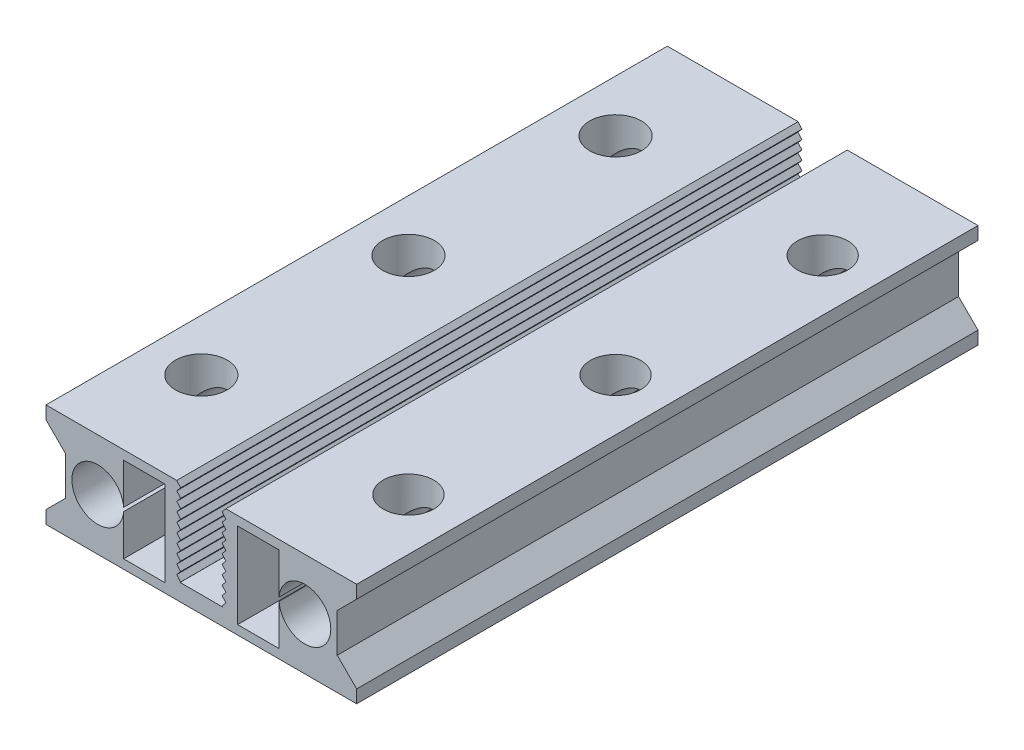
from build123d import *

# Parameters (mm, degrees)
EXTRUDE_2_DEPTH        = 48
EXTRUDE_3_DEPTH        = 48
PATTERN_LINEAR_1_COUNT = 10
PATTERN_LINEAR_1_PITCH = 0.7
MIRROR_1_COPY_1_DEPTH  = 48
MIRROR_1_COPY_2_DEPTH  = 48
MIRROR_1_COPY_3_DEPTH  = 48
MIRROR_1_COPY_4_DEPTH  = 48
MIRROR_1_COPY_5_DEPTH  = 48
MIRROR_1_COPY_6_DEPTH  = 48
MIRROR_1_COPY_7_DEPTH  = 48
MIRROR_1_COPY_8_DEPTH  = 48
MIRROR_1_COPY_9_DEPTH  = 48
SKETCH_4_R             = 2
SKETCH_4_R_2           = 1.95
CUT_EXTRUDE_1_DEPTH    = 51.119856345
PATTERN_LINEAR_2_COUNT = 3
PATTERN_LINEAR_2_PITCH = 16


with BuildPart() as part:
    # 草图1 → 凸台-拉伸2 (new body)
    with BuildSketch(Plane.XY):
        Polygon((-1.9, 8), (-12, 8), (-12, 7), (-10.5, 5.5), (-10.5, 2.5), (-12, 1), (-12, 0), (12, 0), (12, 1), (10.5, 2.5), (10.5, 5.5), (12, 7), (12, 8), (1.9, 8), (1.9, 1.3), (-1.9, 1.3), align=None)
        with BuildLine():
            Line((-6.005, 4.14133294), (-6.005, 7.3))
            Line((-6.005, 7.3), (-2.8, 7.3))
            Line((-2.8, 7.3), (-2.8, 0.7))
            Line((-2.8, 0.7), (-6.005, 0.7))
            Line((-6.005, 0.7), (-6.005, 3.85866706))
            ThreePointArc((-6.005, 3.85866706), (-10, 4), (-6.005, 4.14133294))
        make_face(mode=Mode.SUBTRACT)
        with BuildLine():
            Line((2.8, 0.7), (2.8, 7.3))
            Line((2.8, 7.3), (6.005, 7.3))
            Line((6.005, 7.3), (6.005, 4.14133294))
            ThreePointArc((6.005, 4.14133294), (10, 4), (6.005, 3.85866706))
            Line((6.005, 3.85866706), (6.005, 0.7))
            Line((6.005, 0.7), (2.8, 0.7))
        make_face(mode=Mode.SUBTRACT)
    extrude(amount=EXTRUDE_2_DEPTH)

    # 草图3 → 凸台-拉伸3 (add)
    with BuildSketch(Plane.XY.offset(48)):
        Polygon((-1.9, 8), (-1.6, 7.65), (-1.9, 7.3), align=None)
    extrude_3 = extrude(amount=-EXTRUDE_3_DEPTH)

    # 阵列(线性)1: 凸台-拉伸3 ×10
    with Locations(*[(0, -i * PATTERN_LINEAR_1_PITCH, 0) for i in range(1, PATTERN_LINEAR_1_COUNT)]):
        add(extrude_3)

    # 镜向1: 凸台-拉伸3 across plane
    add(extrude_3.mirror(Plane(origin=(0, 0, 0), x_dir=(0, 0, 1), z_dir=(1, 0, 0))))

    # 镜向1 copy 1 sketch → 镜向1 copy 1 (add)
    with BuildSketch(Plane(origin=(0, -0.7, 48), x_dir=(-1, 0, 0), z_dir=(0, 0, 1))):
        Polygon((-1.9, -8), (-1.6, -7.65), (-1.9, -7.3), align=None)
    extrude(amount=-MIRROR_1_COPY_1_DEPTH)

    # 镜向1 copy 2 sketch → 镜向1 copy 2 (add)
    with BuildSketch(Plane(origin=(0, -1.4, 48), x_dir=(-1, 0, 0), z_dir=(0, 0, 1))):
        Polygon((-1.9, -8), (-1.6, -7.65), (-1.9, -7.3), align=None)
    extrude(amount=-MIRROR_1_COPY_2_DEPTH)

    # 镜向1 copy 3 sketch → 镜向1 copy 3 (add)
    with BuildSketch(Plane(origin=(0, -2.1, 48), x_dir=(-1, 0, 0), z_dir=(0, 0, 1))):
        Polygon((-1.9, -8), (-1.6, -7.65), (-1.9, -7.3), align=None)
    extrude(amount=-MIRROR_1_COPY_3_DEPTH)

    # 镜向1 copy 4 sketch → 镜向1 copy 4 (add)
    with BuildSketch(Plane(origin=(0, -2.8, 48), x_dir=(-1, 0, 0), z_dir=(0, 0, 1))):
        Polygon((-1.9, -8), (-1.6, -7.65), (-1.9, -7.3), align=None)
    extrude(amount=-MIRROR_1_COPY_4_DEPTH)

    # 镜向1 copy 5 sketch → 镜向1 copy 5 (add)
    with BuildSketch(Plane(origin=(0, -3.5, 48), x_dir=(-1, 0, 0), z_dir=(0, 0, 1))):
        Polygon((-1.9, -8), (-1.6, -7.65), (-1.9, -7.3), align=None)
    extrude(amount=-MIRROR_1_COPY_5_DEPTH)

    # 镜向1 copy 6 sketch → 镜向1 copy 6 (add)
    with BuildSketch(Plane(origin=(0, -4.2, 48), x_dir=(-1, 0, 0), z_dir=(0, 0, 1))):
        Polygon((-1.9, -8), (-1.6, -7.65), (-1.9, -7.3), align=None)
    extrude(amount=-MIRROR_1_COPY_6_DEPTH)

    # 镜向1 copy 7 sketch → 镜向1 copy 7 (add)
    with BuildSketch(Plane(origin=(0, -4.9, 48), x_dir=(-1, 0, 0), z_dir=(0, 0, 1))):
        Polygon((-1.9, -8), (-1.6, -7.65), (-1.9, -7.3), align=None)
    extrude(amount=-MIRROR_1_COPY_7_DEPTH)

    # 镜向1 copy 8 sketch → 镜向1 copy 8 (add)
    with BuildSketch(Plane(origin=(0, -5.6, 48), x_dir=(-1, 0, 0), z_dir=(0, 0, 1))):
        Polygon((-1.9, -8), (-1.6, -7.65), (-1.9, -7.3), align=None)
    extrude(amount=-MIRROR_1_COPY_8_DEPTH)

    # 镜向1 copy 9 sketch → 镜向1 copy 9 (add)
    with BuildSketch(Plane(origin=(0, -6.3, 48), x_dir=(-1, 0, 0), z_dir=(0, 0, 1))):
        Polygon((-1.9, -8), (-1.6, -7.65), (-1.9, -7.3), align=None)
    extrude(amount=-MIRROR_1_COPY_9_DEPTH)

    # 草图4 → 切除-拉伸1 (cut, through all)
    with BuildSketch(Plane(origin=(0, 8, 0), x_dir=(1, 0, 0), z_dir=(0, 1, 0))):
        with Locations(Location((-8, -8, 0), (0, 0, 180))):
            Circle(SKETCH_4_R)
        with Locations(Location((8, -8, 0), (0, 0, 180))):
            Circle(SKETCH_4_R_2)
    cut_extrude_1 = extrude(amount=-CUT_EXTRUDE_1_DEPTH, mode=Mode.SUBTRACT)

    # 阵列(线性)2: 切除-拉伸1 ×3
    with Locations(*[(0, 0, i * PATTERN_LINEAR_2_PITCH) for i in range(1, PATTERN_LINEAR_2_COUNT)]):
        add(cut_extrude_1, mode=Mode.SUBTRACT)


solid = part.part
